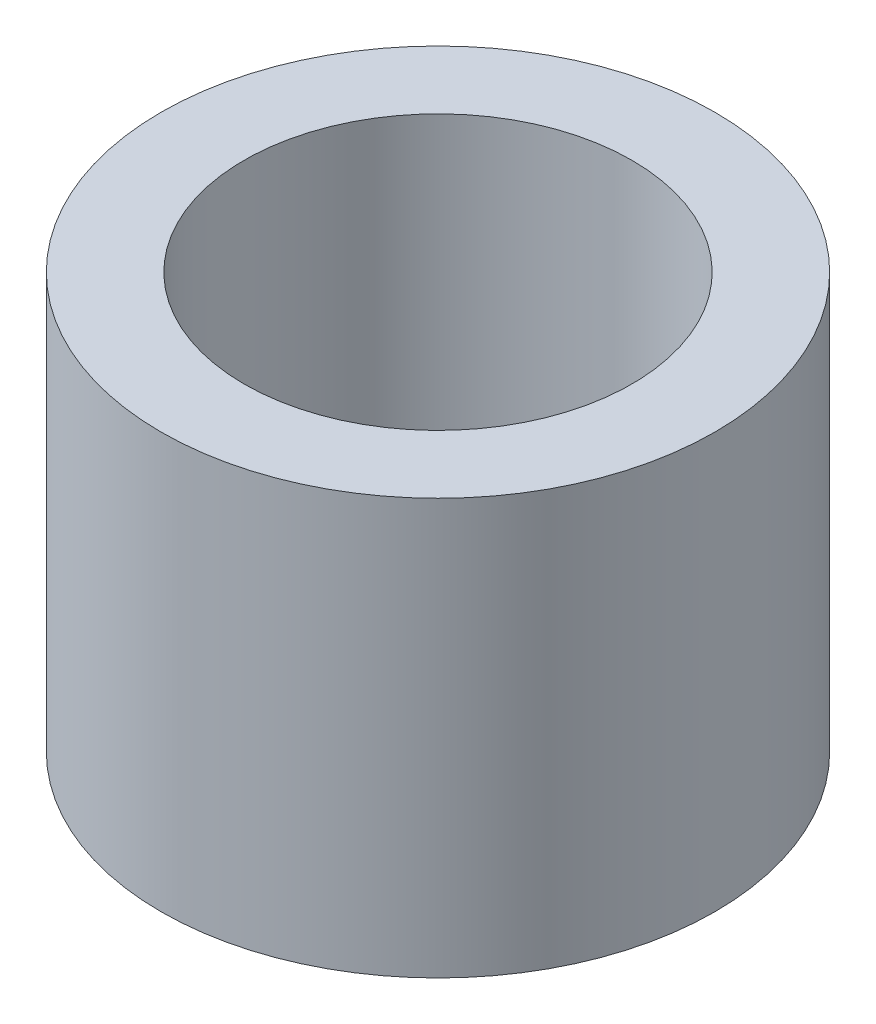
from build123d import *

# Parameters (mm, degrees)
SKETCH1_R           = 7
BOSS_EXTRUDE1_DEPTH = 15
SHELL2_T            = 3


with BuildPart() as part:
    # Sketch1 → Boss-Extrude1 (new body)
    with BuildSketch(Plane(origin=(0, 0, 0), x_dir=(1, 0, 0), z_dir=(0, 1, 0))):
        with Locations(Location((0, 0, 0), (0, 0, 270))):
            Circle(SKETCH1_R)
    extrude(amount=BOSS_EXTRUDE1_DEPTH)

    # Shell2
    shell2_openings = [part.faces().sort_by_distance(p)[0] for p in [
        (0, 0, 0),
        (0, 15, 0),
    ]]
    offset(amount=SHELL2_T, openings=shell2_openings, kind=Kind.INTERSECTION)


solid = part.part
